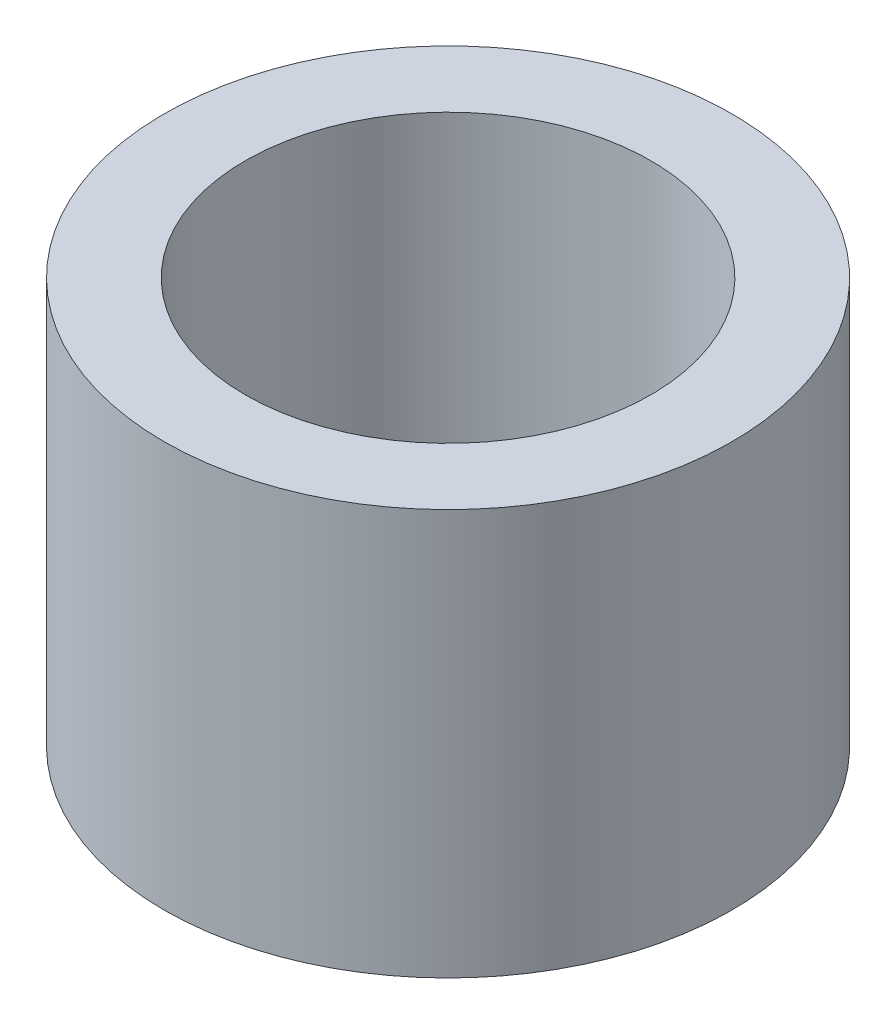
from build123d import *

# Parameters (mm, degrees)
CROQUIS1_R              = 3.5
CROQUIS1_R_2            = 2.5
SALIENTE_EXTRUIR1_DEPTH = 5


with BuildPart() as part:
    # Croquis1 → Saliente-Extruir1 (new body)
    with BuildSketch(Plane(origin=(0, 0, 0), x_dir=(1, 0, 0), z_dir=(0, 1, 0))):
        with Locations(Location((0, 0, 0), (0, 0, 270))):
            Circle(CROQUIS1_R)
        with Locations(Location((0, 0, 0), (0, 0, 270))):
            Circle(CROQUIS1_R_2, mode=Mode.SUBTRACT)
    extrude(amount=SALIENTE_EXTRUIR1_DEPTH)


solid = part.part
